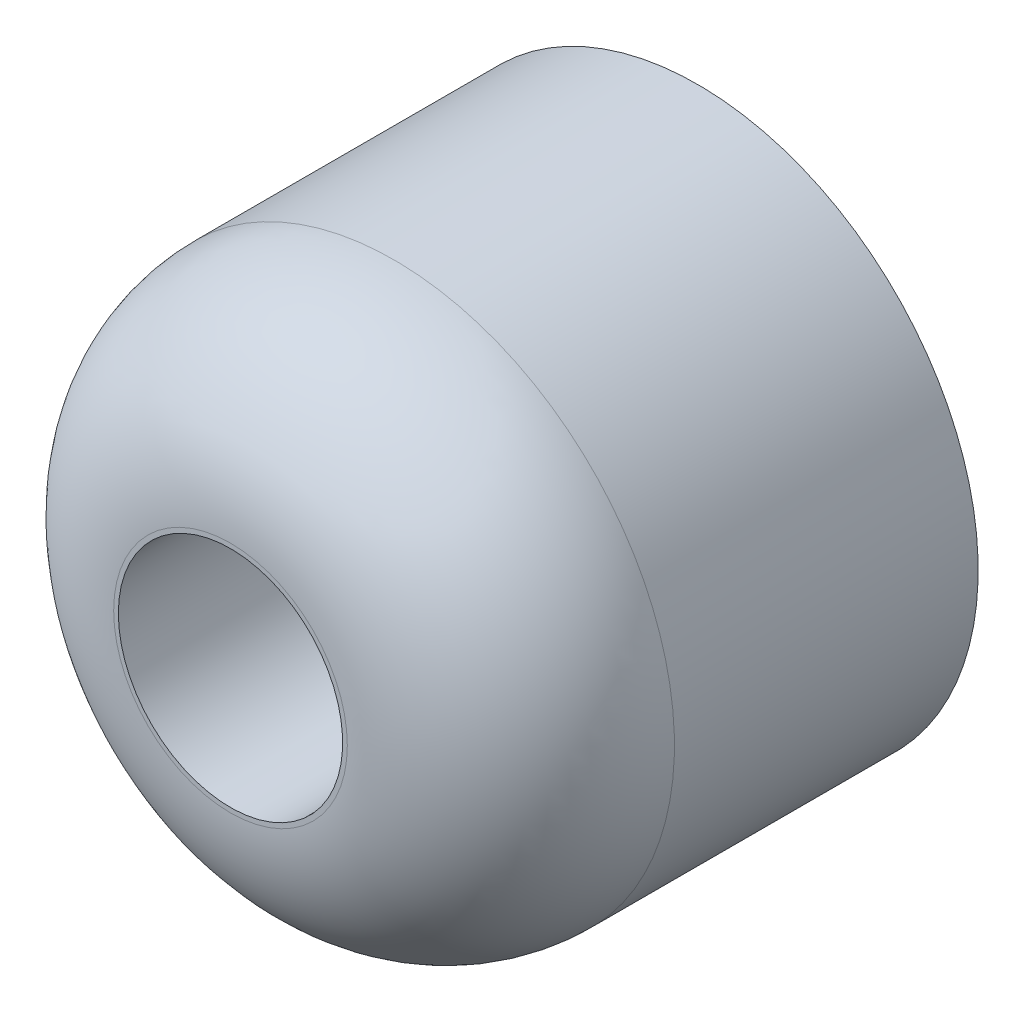
from build123d import *


with BuildPart() as part:
    # Sketch1 → Revolve1 (revolve)
    with BuildSketch(Plane(origin=(0, 0, 0), x_dir=(0, 0, -1), z_dir=(1, 0, 0)), mode=Mode.PRIVATE) as revolve1_sk:
        with BuildLine():
            Line((0, 2.4), (-10, 2.4))
            Line((-10, 2.4), (-10, 2.5))
            ThreePointArc((-10, 2.5), (-8.974873734, 4.974873734), (-6.5, 6))
            Line((-6.5, 6), (0, 6))
            Line((0, 6), (0, 5.5))
            Line((0, 5.5), (-6, 5.5))
            Line((-6, 5.5), (-6, 3.9))
            Line((-6, 3.9), (0, 3.9))
            Line((0, 3.9), (0, 2.4))
        make_face()
    revolve(revolve1_sk.sketch.rotate(Axis((0, 0, 0), (0, 0, 1)), 90), axis=Axis((0, 0, 0), (0, 0, 1)))


solid = part.part
